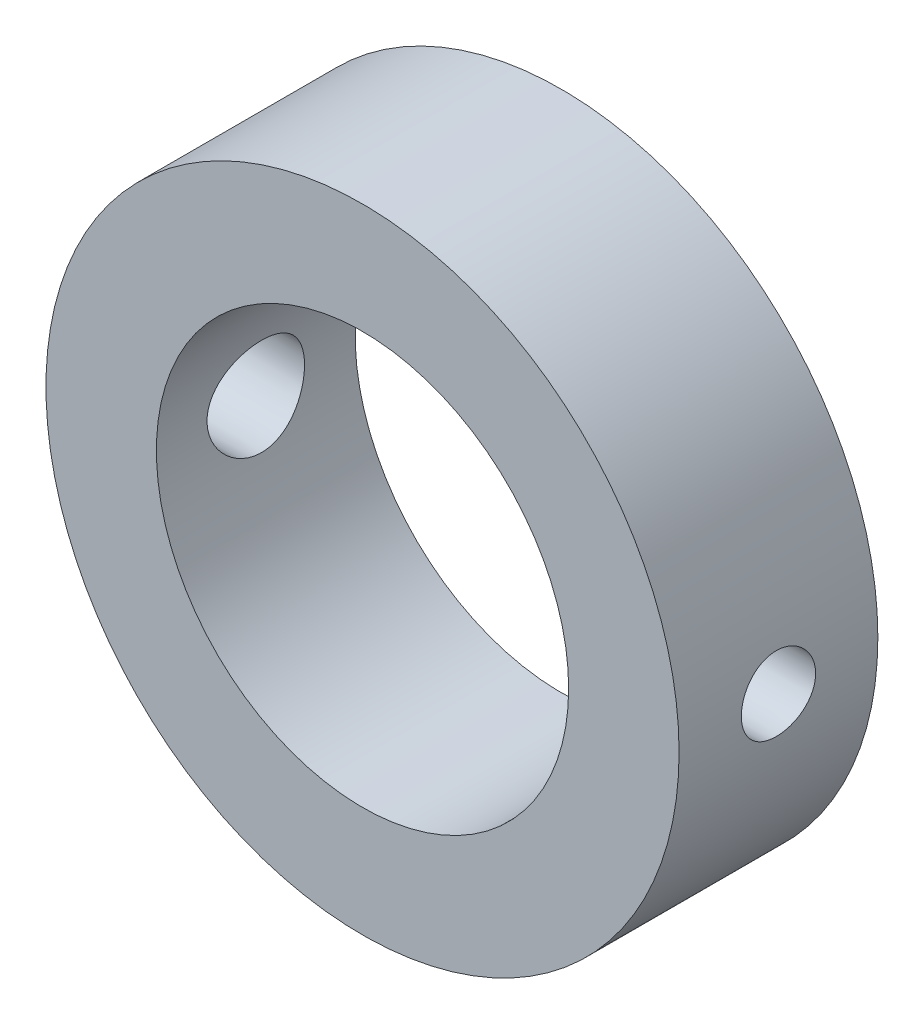
from build123d import *

# Parameters (mm, degrees)
SKETCH1_R           = 43
SKETCH1_R_2         = 28
BOSS_EXTRUDE1_DEPTH = 13.5


with BuildPart() as part:
    # Sketch1 → Boss-Extrude1 (new, symmetric)
    with BuildSketch(Plane.XY):
        Circle(SKETCH1_R)
        Circle(SKETCH1_R_2, mode=Mode.SUBTRACT)
    extrude(amount=BOSS_EXTRUDE1_DEPTH, both=True)

    # Sketch4 → Cut-Revolve1 (revolve, cut)
    with BuildSketch(Plane(origin=(0, 0, 0), x_dir=(1, 0, 0), z_dir=(0, 1, 0))):
        Polygon((-45, 0), (-45, 7), (45, 5), (45, 0), align=None)
    revolve(axis=Axis((0, 0, 0), (-1, 0, 0)), mode=Mode.SUBTRACT)


solid = part.part
